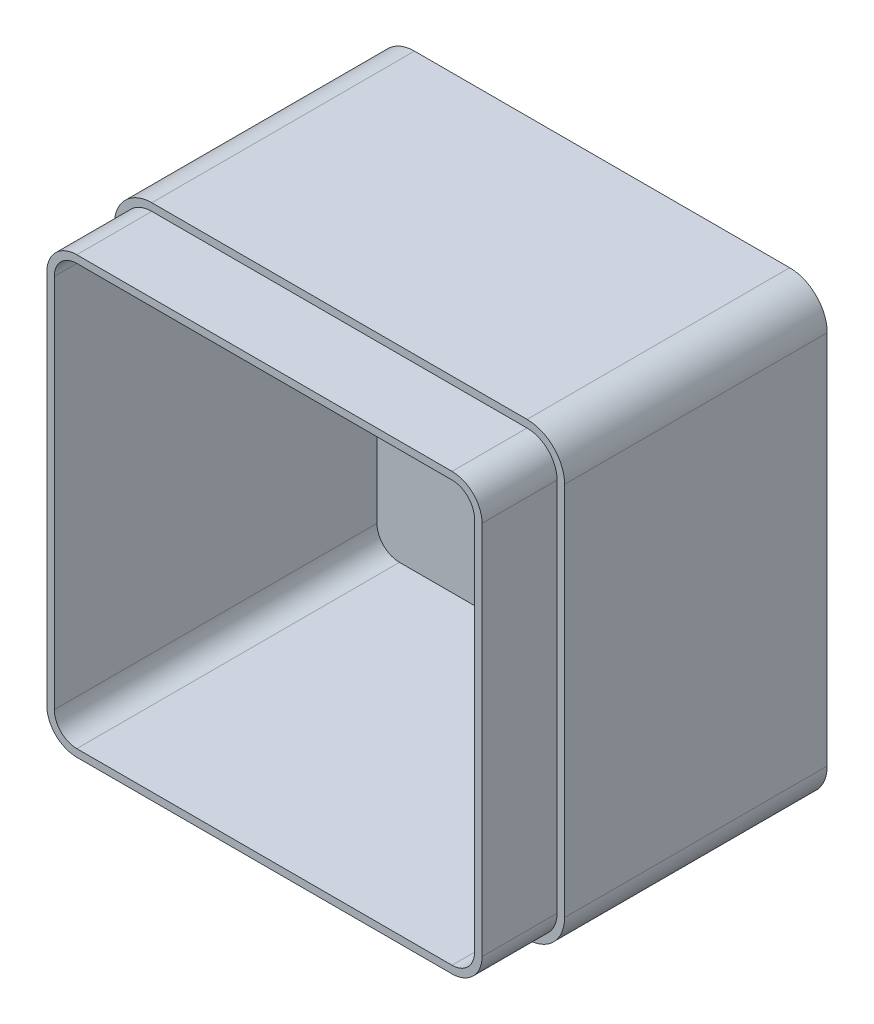
from build123d import *

# Parameters (mm, degrees)
SKETCH1_W           = 120
SKETCH1_H           = 120
BOSS_EXTRUDE1_DEPTH = 90
FILLET1_R           = 10
SHELL1_T            = -4
CUT_EXTRUDE1_DEPTH  = 20


with BuildPart() as part:
    # Sketch1 → Boss-Extrude1 (new body)
    with BuildSketch(Plane.XY):
        Rectangle(SKETCH1_W, SKETCH1_H)
    extrude(amount=BOSS_EXTRUDE1_DEPTH)

    # Fillet1
    fillet1_edges = [part.edges().sort_by_distance(p)[0] for p in [
        (-60, 60, 45),
        (60, 60, 45),
        (60, -60, 45),
        (-60, -60, 45),
    ]]
    fillet(fillet1_edges, radius=FILLET1_R)

    # Shell1
    shell1_openings = [part.faces().sort_by_distance(p)[0] for p in [
        (0, 0, 90),
    ]]
    offset(amount=SHELL1_T, openings=shell1_openings, kind=Kind.INTERSECTION)

    # Sketch2 → Cut-Extrude1 (cut)
    with BuildSketch(Plane.XY.offset(90)):
        with BuildLine():
            Line((50, 60), (-50, 60))
            ThreePointArc((-50, 60), (-57.071067812, 57.071067812), (-60, 50))
            Line((-60, 50), (-60, -50))
            ThreePointArc((-60, -50), (-57.071067812, -57.071067812), (-50, -60))
            Line((-50, -60), (50, -60))
            ThreePointArc((50, -60), (57.071067812, -57.071067812), (60, -50))
            Line((60, -50), (60, 50))
            ThreePointArc((60, 50), (57.071067812, 57.071067812), (50, 60))
        make_face()
        with BuildLine():
            Line((50, 58), (-50, 58))
            ThreePointArc((-50, 58), (-55.656854249, 55.656854249), (-58, 50))
            Line((-58, 50), (-58, -50))
            ThreePointArc((-58, -50), (-55.656854249, -55.656854249), (-50, -58))
            Line((-50, -58), (50, -58))
            ThreePointArc((50, -58), (55.656854249, -55.656854249), (58, -50))
            Line((58, -50), (58, 50))
            ThreePointArc((58, 50), (55.656854249, 55.656854249), (50, 58))
        make_face(mode=Mode.SUBTRACT)
    extrude(amount=-CUT_EXTRUDE1_DEPTH, mode=Mode.SUBTRACT)


solid = part.part
